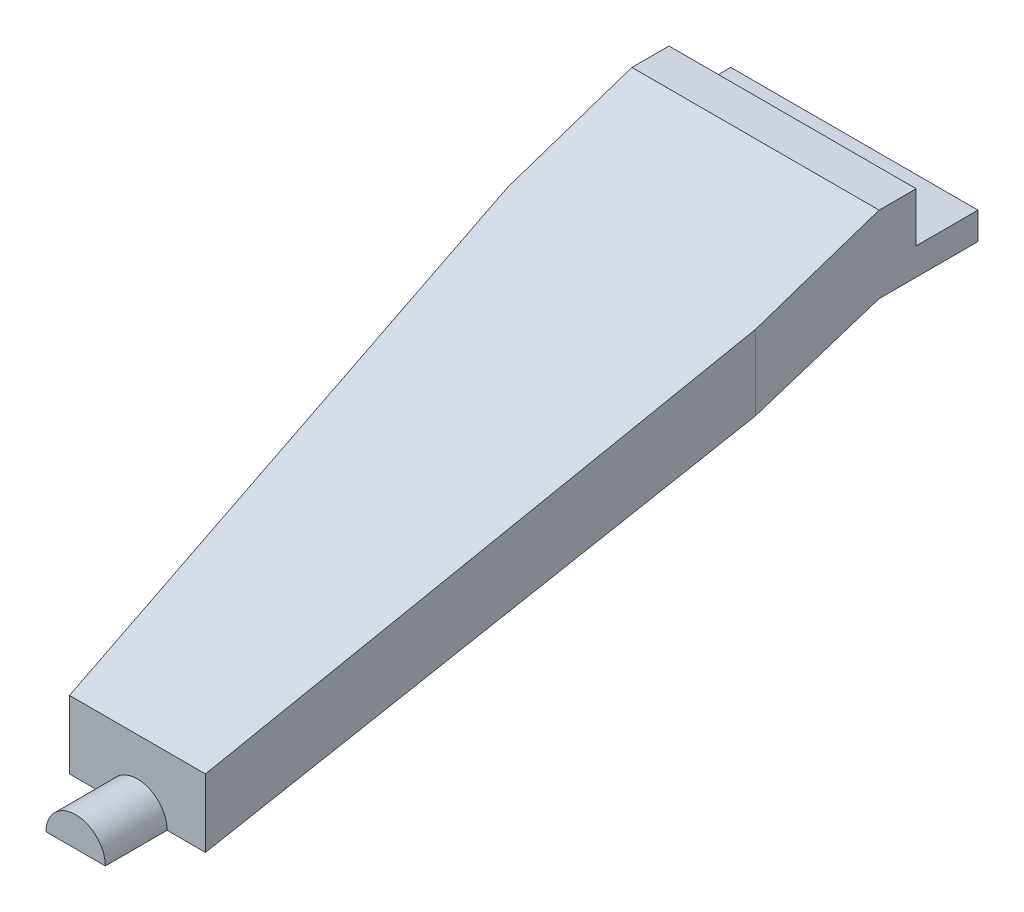
from build123d import *

# Parameters (mm, degrees)
SKETCH_1_W          = 20
SKETCH_1_H          = 5
SKETCH_1_R          = 0.8
EXTRUDE_1_DEPTH     = 2.2
SKETCH_2_W          = 20
SKETCH_2_H          = 6.2
EXTRUDE_2_DEPTH     = 3
SKETCH_3_W          = 5
SKETCH_3_H          = 5.5
EXTRUDE_3_DEPTH     = 20
SKETCH_4_W          = 4.5
SKETCH_4_H          = 5
CUT_EXTRUDE_1_DEPTH = 70.742831173
CUT_EXTRUDE_2_DEPTH = 5


with BuildPart() as part:
    # 草图1 → 凸台-拉伸1 (new body)
    with BuildSketch(Plane(origin=(0, 0, 0), x_dir=(1, 0, 0), z_dir=(0, 1, 0))):
        with Locations((10, -2.5)):
            Rectangle(SKETCH_1_W, SKETCH_1_H)
        with Locations(Location((4, -2.5, 0), (0, 0, 270))):
            Circle(SKETCH_1_R, mode=Mode.SUBTRACT)
        with Locations(Location((16, -2.5, 0), (0, 0, 270))):
            Circle(SKETCH_1_R, mode=Mode.SUBTRACT)
    extrude(amount=EXTRUDE_1_DEPTH)

    # 草图2 → 凸台-拉伸2 (add)
    with BuildSketch(Plane.XY.offset(5)):
        with Locations((10, 3.1)):
            Rectangle(SKETCH_2_W, SKETCH_2_H)
    extrude(amount=EXTRUDE_2_DEPTH)

    # 草图3 → 凸台-拉伸3 (add, through all)
    with BuildSketch(Plane(origin=(20, 0, 0), x_dir=(0, 0, -1), z_dir=(1, 0, 0))):
        Polygon((-58, -10.55), (-58, -16.05), (-8, 0), (-8, 6.2), align=None)
        with Locations((-60.5, -13.3)):
            Rectangle(SKETCH_3_W, SKETCH_3_H)
    extrude(amount=-EXTRUDE_3_DEPTH)

    # 草图4 → 切除-拉伸1 (cut, through all)
    with BuildSketch(Plane(origin=(0, 6.2, 0), x_dir=(1, 0, 0), z_dir=(0, 1, 0))):
        Polygon((4.5, -58), (0, -18), (0, -58), align=None)
        Polygon((20, -58), (20, -18), (15.5, -58), align=None)
        with Locations((17.75, -60.5)):
            Rectangle(SKETCH_4_W, SKETCH_4_H)
        with Locations((2.25, -60.5)):
            Rectangle(SKETCH_4_W, SKETCH_4_H)
    extrude(amount=-CUT_EXTRUDE_1_DEPTH, mode=Mode.SUBTRACT)

    # 草图5 → 切除-拉伸2 (cut)
    with BuildSketch(Plane.XY.offset(63)):
        with BuildLine():
            Line((15.5, -10.55), (4.5, -10.55))
            Line((4.5, -10.55), (4.5, -16.05))
            Line((4.5, -16.05), (7.6, -16.05))
            ThreePointArc((7.6, -16.05), (10, -13.65), (12.4, -16.05))
            Line((12.4, -16.05), (15.5, -16.05))
            Line((15.5, -16.05), (15.5, -10.55))
        make_face()
    extrude(amount=-CUT_EXTRUDE_2_DEPTH, mode=Mode.SUBTRACT)


solid = part.part
